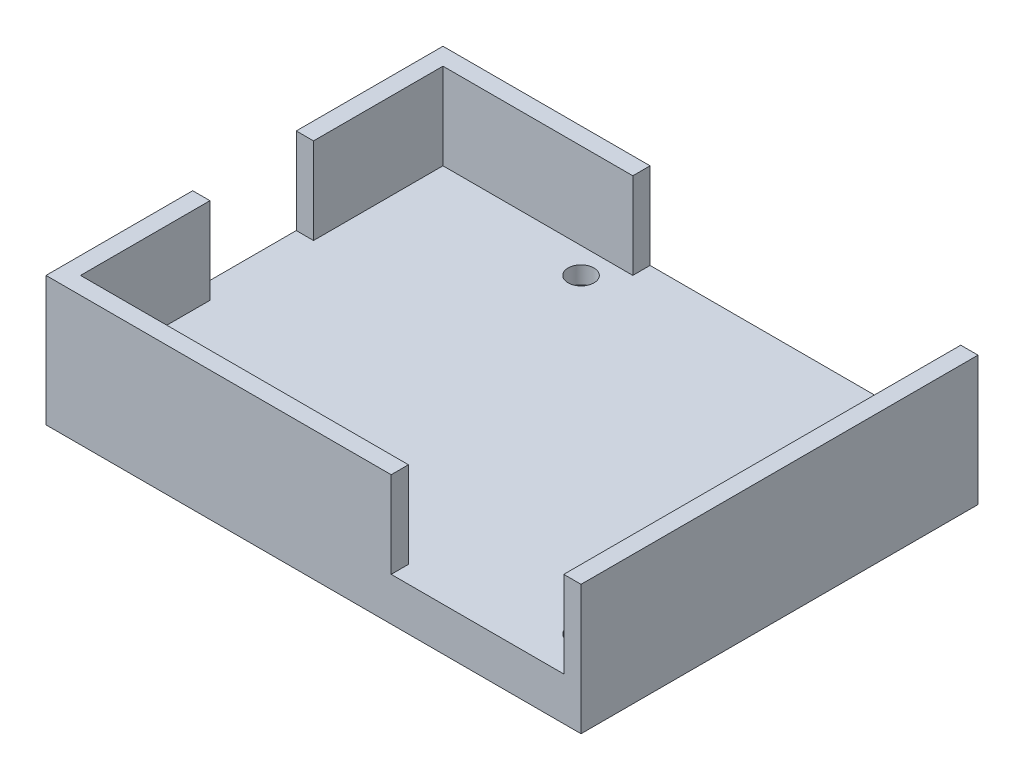
from build123d import *

# Parameters (mm, degrees)
SKETCH_1_W          = 62
SKETCH_1_H          = 46
EXTRUDE_1_DEPTH     = 15
SKETCH_2_W          = 58
SKETCH_2_H          = 42
CUT_EXTRUDE_1_DEPTH = 10
CUT_EXTRUDE_2_REACH = 69.809
SKETCH_3_W          = 12
SKETCH_3_H          = 20
CUT_EXTRUDE_3_REACH = 57.875
SKETCH_5_W          = 36
SKETCH_5_H          = 10
CUT_EXTRUDE_4_REACH = 57.875
SKETCH_6_W          = 20
SKETCH_6_H          = 10
SKETCH_7_R          = 1.5
CUT_EXTRUDE_5_DEPTH = 40.874804075
SKETCH_8_R          = 2
CUT_EXTRUDE_6_DEPTH = 3


with BuildPart() as part:
    # 草图1 → 凸台-拉伸1 (new body)
    with BuildSketch(Plane(origin=(0, 0, 0), x_dir=(1, 0, 0), z_dir=(0, 1, 0))):
        Rectangle(SKETCH_1_W, SKETCH_1_H)
    extrude(amount=EXTRUDE_1_DEPTH)

    # 草图2 → 切除-拉伸1 (cut)
    with BuildSketch(Plane(origin=(0, 15, 0), x_dir=(1, 0, 0), z_dir=(0, 1, 0))):
        Rectangle(SKETCH_2_W, SKETCH_2_H)
    extrude(amount=-CUT_EXTRUDE_1_DEPTH, mode=Mode.SUBTRACT)

    # 草图3 → 切除-拉伸2 (cut, up to next)
    with BuildSketch(Plane.ZY.offset(31), mode=Mode.PRIVATE) as cut_extrude_2_sk1:
        with Locations((0, 15)):
            Rectangle(SKETCH_3_W, SKETCH_3_H)
    cut_extrude_2_tool1 = extrude(cut_extrude_2_sk1.sketch, amount=-CUT_EXTRUDE_2_REACH, mode=Mode.PRIVATE) & part.part
    add(cut_extrude_2_tool1.solids().sort_by_distance((-31, 15, 0))[0], mode=Mode.SUBTRACT)

    # 草图5 → 切除-拉伸3 (cut, up to next)
    with BuildSketch(Plane.XY.offset(-21), mode=Mode.PRIVATE) as cut_extrude_3_sk1:
        with Locations((11, 10)):
            Rectangle(SKETCH_5_W, SKETCH_5_H)
    cut_extrude_3_tool1 = extrude(cut_extrude_3_sk1.sketch, amount=-CUT_EXTRUDE_3_REACH, mode=Mode.PRIVATE) & part.part
    add(cut_extrude_3_tool1.solids().sort_by_distance((11, 10, -21))[0], mode=Mode.SUBTRACT)

    # 草图6 → 切除-拉伸4 (cut, up to next)
    with BuildSketch(Plane(origin=(0, 0, 21), x_dir=(-1, 0, 0), z_dir=(0, 0, -1)), mode=Mode.PRIVATE) as cut_extrude_4_sk1:
        with Locations((-19, 10)):
            Rectangle(SKETCH_6_W, SKETCH_6_H)
    cut_extrude_4_tool1 = extrude(cut_extrude_4_sk1.sketch, amount=-CUT_EXTRUDE_4_REACH, mode=Mode.PRIVATE) & part.part
    add(cut_extrude_4_tool1.solids().sort_by_distance((19, 10, 21))[0], mode=Mode.SUBTRACT)

    # 草图7 → 切除-拉伸5 (cut, through all)
    with BuildSketch(Plane(origin=(0, 5, 0), x_dir=(1, 0, 0), z_dir=(0, 1, 0))):
        with Locations(Location((26, -18, 0), (0, 0, 270))):
            Circle(SKETCH_7_R)
        with Locations(Location((26, 18, 0), (0, 0, 270))):
            Circle(SKETCH_7_R)
        with Locations(Location((-10, 18, 0), (0, 0, 270))):
            Circle(SKETCH_7_R)
        with Locations(Location((-10, -18, 0), (0, 0, 270))):
            Circle(SKETCH_7_R)
    extrude(amount=-CUT_EXTRUDE_5_DEPTH, mode=Mode.SUBTRACT)

    # 草图8 → 切除-拉伸6 (cut)
    with BuildSketch(Plane.XZ):
        with Locations(Location((-10, 18, 0), (0, 0, 270))):
            Circle(SKETCH_8_R)
        with Locations(Location((26, 18, 0), (0, 0, 270))):
            Circle(SKETCH_8_R)
        with Locations(Location((26, -18, 0), (0, 0, 270))):
            Circle(SKETCH_8_R)
        with Locations(Location((-10, -18, 0), (0, 0, 270))):
            Circle(SKETCH_8_R)
    extrude(amount=-CUT_EXTRUDE_6_DEPTH, mode=Mode.SUBTRACT)


solid = part.part
